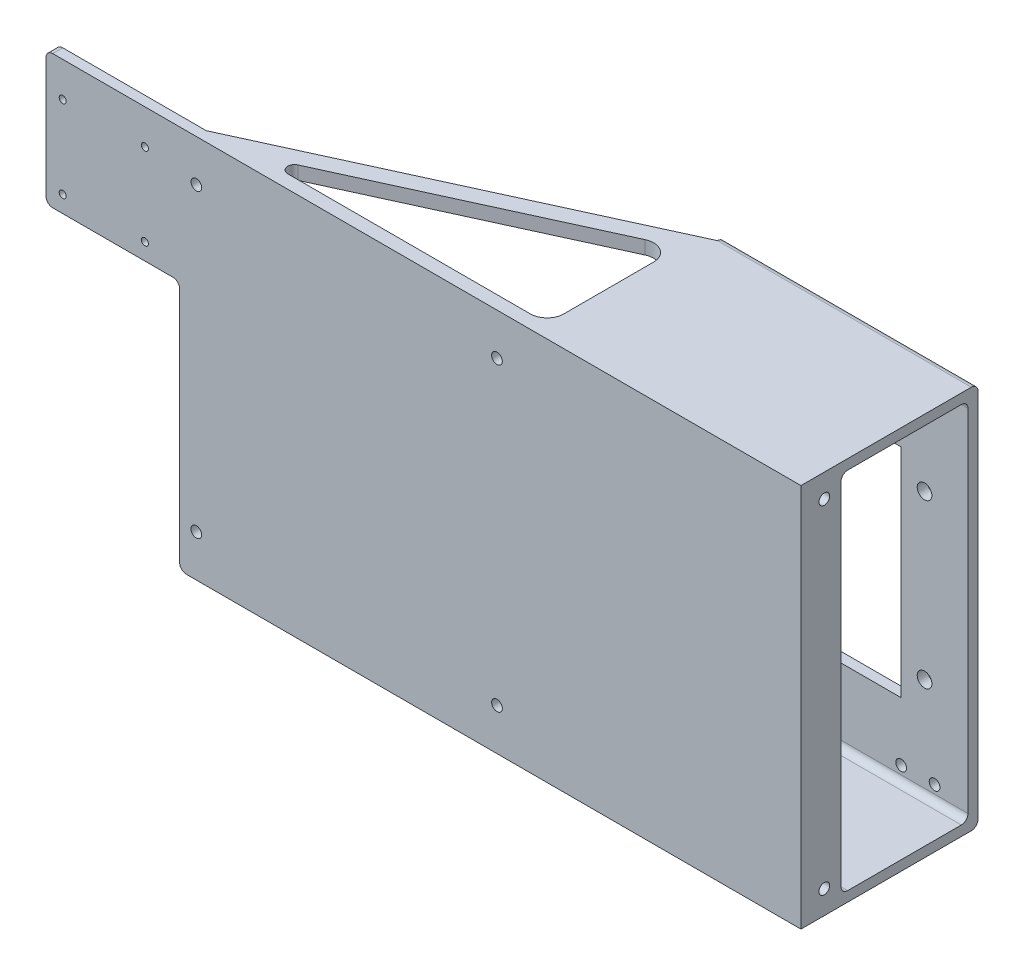
from build123d import *

# Parameters (mm, degrees)
SKETCH_2_W          = 76
SKETCH_2_H          = 115
SKETCH_2_R          = 2.2
SKETCH_2_R_2        = 1.6
EXTRUDE_1_DEPTH     = 3
EXTRUDE_2_DEPTH     = 76
SKETCH_4_W          = 47
SKETCH_4_H          = 108.999999999
EXTRUDE_3_DEPTH     = 3
SKETCH_5_W          = 12
SKETCH_5_H          = 115
SKETCH_5_R          = 1.6
EXTRUDE_4_DEPTH     = 3
FILLET_1_R          = 2
SKETCH_6_W          = 3
SKETCH_6_H          = 115
EXTRUDE_5_DEPTH     = 110
SKETCH_7_R          = 1.6
CUT_EXTRUDE_1_DEPTH = 110
SKETCH_8_W          = 31
SKETCH_8_H          = 65
CUT_EXTRUDE_2_DEPTH = 3
EXTRUDE_6_DEPTH     = 4
EXTRUDE_7_DEPTH     = 4
CUT_EXTRUDE_3_DEPTH = 124
SKETCH_16_W         = 3
SKETCH_16_H         = 40
EXTRUDE_10_DEPTH    = 40
SKETCH_17_R         = 1.05
CUT_EXTRUDE_5_DEPTH = 40
FILLET_5_R          = 2
SKETCH_18_W         = 22
SKETCH_18_H         = 87
CUT_EXTRUDE_6_DEPTH = 4


with BuildPart() as part:
    # 草图2 → 凸台-拉伸1 (new body)
    with BuildSketch(Plane.XY):
        with Locations((61.052848474, -66.98174403)):
            Rectangle(SKETCH_2_W, SKETCH_2_H)
        with Locations((86.052848474, -91.272111932)):
            Circle(SKETCH_2_R, mode=Mode.SUBTRACT)
        with Locations((86.052848474, -42.48174403)):
            Circle(SKETCH_2_R, mode=Mode.SUBTRACT)
        with Locations((37.262480572, -42.48174403)):
            Circle(SKETCH_2_R, mode=Mode.SUBTRACT)
        with Locations((37.262480572, -91.272111932)):
            Circle(SKETCH_2_R, mode=Mode.SUBTRACT)
        with Locations((89.052848474, -16.98174403)):
            Circle(SKETCH_2_R_2, mode=Mode.SUBTRACT)
        with Locations((79.052848474, -16.98174403)):
            Circle(SKETCH_2_R_2, mode=Mode.SUBTRACT)
        with Locations((41.052848474, -16.98174403)):
            Circle(SKETCH_2_R_2, mode=Mode.SUBTRACT)
        with Locations((51.052848474, -16.98174403)):
            Circle(SKETCH_2_R_2, mode=Mode.SUBTRACT)
        with Locations((41.052848474, -116.98174403)):
            Circle(SKETCH_2_R_2, mode=Mode.SUBTRACT)
        with Locations((51.052848474, -116.98174403)):
            Circle(SKETCH_2_R_2, mode=Mode.SUBTRACT)
        with Locations((79.052848474, -116.98174403)):
            Circle(SKETCH_2_R_2, mode=Mode.SUBTRACT)
        with Locations((89.052848474, -116.98174403)):
            Circle(SKETCH_2_R_2, mode=Mode.SUBTRACT)
    extrude(amount=EXTRUDE_1_DEPTH)

    # 草图3 → 凸台-拉伸2 (add)
    with BuildSketch(Plane.ZY.offset(-23.052848474)):
        Polygon((0, -9.48174403), (53, -9.48174403), (53, -124.48174403), (0, -124.48174403), (0, -121.48174403), (50, -121.48174403), (50, -12.481744031), (0, -12.481744031), align=None)
    extrude(amount=-EXTRUDE_2_DEPTH)

    # 草图4 → 凸台-拉伸3 (add)
    with BuildSketch(Plane.ZY.offset(-23.052848474)):
        with Locations((26.5, -66.98174403)):
            Rectangle(SKETCH_4_W, SKETCH_4_H)
    extrude(amount=-EXTRUDE_3_DEPTH)

    # 草图5 → 凸台-拉伸4 (add)
    with BuildSketch(Plane(origin=(99.052848474, 0, 0), x_dir=(0, 0, -1), z_dir=(1, 0, 0))):
        with Locations((-47, -66.98174403)):
            Rectangle(SKETCH_5_W, SKETCH_5_H)
        with Locations(Location((-46, -117.48174403, 0), (0, 0, 90))):
            Circle(SKETCH_5_R, mode=Mode.SUBTRACT)
        with Locations(Location((-46, -16.48174403, 0), (0, 0, 90))):
            Circle(SKETCH_5_R, mode=Mode.SUBTRACT)
    extrude(amount=-EXTRUDE_4_DEPTH)

    # 圆角1
    fillet_1_edges = [part.edges().sort_by_distance(p)[0] for p in [
        (62.552848474, -12.481744031, 3),
        (61.052848474, -12.481744031, 50),
        (61.052848474, -121.48174403, 50),
        (97.552848474, -121.48174403, 41),
        (97.552848474, -12.481744031, 41),
        (61.052848474, -9.48174403, 0),
        (61.052848474, -124.48174403, 0),
        (62.552848474, -121.48174403, 3),
    ]]
    fillet(fillet_1_edges, radius=FILLET_1_R)

    # 草图6 → 凸台-拉伸5 (add)
    with BuildSketch(Plane.ZY.offset(-23.052848474)):
        with Locations((51.5, -66.98174403)):
            Rectangle(SKETCH_6_W, SKETCH_6_H)
    extrude(amount=EXTRUDE_5_DEPTH)

    # 草图7 → 切除-拉伸1 (cut)
    with BuildSketch(Plane(origin=(0, 0, 50), x_dir=(-1, 0, 0), z_dir=(0, 0, -1))):
        with Locations(Location((81.947151526, -21.98174403, 0), (0, 0, 90))):
            Circle(SKETCH_7_R)
        with Locations(Location((81.947151526, -111.98174403, 0), (0, 0, 90))):
            Circle(SKETCH_7_R)
        with Locations(Location((-8.052848474, -21.98174403, 0), (0, 0, 90))):
            Circle(SKETCH_7_R)
        with Locations(Location((-8.052848474, -111.98174403, 0), (0, 0, 90))):
            Circle(SKETCH_7_R)
    extrude(amount=-CUT_EXTRUDE_1_DEPTH, mode=Mode.SUBTRACT)

    # 草图8 → 切除-拉伸2 (cut)
    with BuildSketch(Plane(origin=(0, 0, 0), x_dir=(-1, 0, 0), z_dir=(0, 0, -1))):
        with Locations((-63.552848474, -66.98174403)):
            Rectangle(SKETCH_8_W, SKETCH_8_H)
    extrude(amount=-CUT_EXTRUDE_2_DEPTH, mode=Mode.SUBTRACT)

    # 草图9 → 凸台-拉伸6 (add)
    with BuildSketch(Plane(origin=(0, -124.48174403, 0), x_dir=(-1, 0, 0), z_dir=(0, -1, 0))):
        Polygon((-23.052848474, -2), (81.947151526, -50), (-23.052848474, -50), align=None)
    extrude(amount=-EXTRUDE_6_DEPTH)

    # 草图10 → 凸台-拉伸7 (add)
    with BuildSketch(Plane(origin=(0, -9.48174403, 0), x_dir=(1, 0, 0), z_dir=(0, 1, 0))):
        Polygon((23.052848474, -2), (-81.947151526, -50), (23.052848474, -50), align=None)
    extrude(amount=-EXTRUDE_7_DEPTH)

    # 草图11 → 切除-拉伸3 (cut)
    with BuildSketch(Plane(origin=(0, -124.48174403, 0), x_dir=(-1, 0, 0), z_dir=(0, -1, 0))):
        with BuildLine():
            Line((58.548005297, -49), (-14.052848474, -49))
            ThreePointArc((-14.052848474, -49), (-17.58838238, -47.535533906), (-19.052848474, -44))
            Line((-19.052848474, -44), (-19.052848474, -17.109646517))
            ThreePointArc((-19.052848474, -17.109646517), (-16.755255364, -12.902866632), (-11.974049673, -12.562274139))
            Line((-11.974049673, -12.562274139), (59.379524817, -45.181051049))
            ThreePointArc((59.379524817, -45.181051049), (60.502218425, -47.425500939), (58.548005297, -49))
        make_face()
    extrude(amount=-CUT_EXTRUDE_3_DEPTH, mode=Mode.SUBTRACT)

    # 草图16 → 凸台-拉伸10 (add)
    with BuildSketch(Plane.ZY.offset(86.947151526)):
        with Locations((51.5, -29.48174403)):
            Rectangle(SKETCH_16_W, SKETCH_16_H)
    extrude(amount=EXTRUDE_10_DEPTH)

    # 草图17 → 切除-拉伸5 (cut)
    with BuildSketch(Plane(origin=(0, 0, 50), x_dir=(-1, 0, 0), z_dir=(0, 0, -1))):
        with Locations(Location((121.947151526, -44.48174403, 0), (0, 0, 90))):
            Circle(SKETCH_17_R)
        with Locations(Location((121.947151526, -19.88174403, 0), (0, 0, 90))):
            Circle(SKETCH_17_R)
        with Locations(Location((97.347151526, -19.88174403, 0), (0, 0, 90))):
            Circle(SKETCH_17_R)
        with Locations(Location((97.347151526, -44.48174403, 0), (0, 0, 90))):
            Circle(SKETCH_17_R)
    extrude(amount=-CUT_EXTRUDE_5_DEPTH, mode=Mode.SUBTRACT)

    # 圆角5
    fillet_5_edges = [part.edges().sort_by_distance(p)[0] for p in [
        (-86.947151526, -124.48174403, 51.5),
        (-86.947151526, -49.48174403, 51.5),
        (-126.947151526, -49.48174403, 51.5),
        (-126.947151526, -9.48174403, 51.5),
    ]]
    fillet(fillet_5_edges, radius=FILLET_5_R)

    # 草图18 → 切除-拉伸6 (cut)
    with BuildSketch(Plane.ZY.offset(-23.052848474)):
        with Locations((19, -66.98174403)):
            Rectangle(SKETCH_18_W, SKETCH_18_H)
    extrude(amount=-CUT_EXTRUDE_6_DEPTH, mode=Mode.SUBTRACT)


solid = part.part
